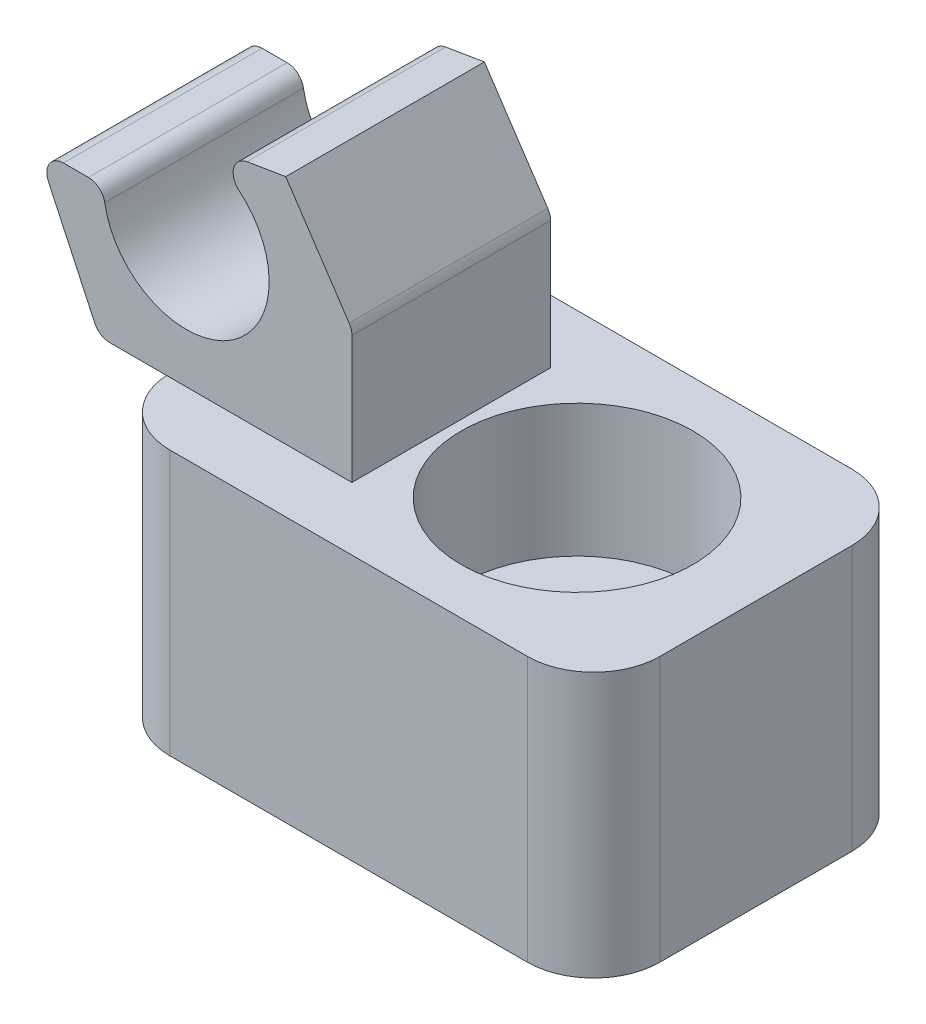
from build123d import *

# Parameters (mm, degrees)
BOSS_EXTRUDE1_DEPTH      = 8
SKETCH2_R                = 3.5
CUT_EXTRUDE1_DEPTH       = 4
SKETCH3_R                = 1.8
CUT_EXTRUDE2_DEPTH       = 4
BOSS_EXTRUDE2_DEPTH      = 3
BOSS_EXTRUDE2_DEPTH_BACK = 3
FILLET1_R                = 0.5


with BuildPart() as part:
    # Sketch1 → Boss-Extrude1 (new body)
    with BuildSketch(Plane(origin=(0, 0, 0), x_dir=(1, 0, 0), z_dir=(0, 1, 0))):
        with BuildLine():
            Line((-5.4, -4.9), (5.4, -4.9))
            ThreePointArc((5.4, -4.9), (6.814213562, -4.314213562), (7.4, -2.9))
            Line((7.4, -2.9), (7.4, 2.9))
            ThreePointArc((7.4, 2.9), (6.814213562, 4.314213562), (5.4, 4.9))
            Line((5.4, 4.9), (-5.4, 4.9))
            ThreePointArc((-5.4, 4.9), (-6.814213562, 4.314213562), (-7.4, 2.9))
            Line((-7.4, 2.9), (-7.4, -2.9))
            ThreePointArc((-7.4, -2.9), (-6.814213562, -4.314213562), (-5.4, -4.9))
        make_face()
    extrude(amount=BOSS_EXTRUDE1_DEPTH)

    # Sketch2 → Cut-Extrude1 (cut)
    with BuildSketch(Plane(origin=(0, 8, 0), x_dir=(1, 0, 0), z_dir=(0, 1, 0))):
        with Locations(Location((2, 0, 0), (0, 0, 270))):
            Circle(SKETCH2_R)
    extrude(amount=-CUT_EXTRUDE1_DEPTH, mode=Mode.SUBTRACT)

    # Sketch3 → Cut-Extrude2 (cut)
    with BuildSketch(Plane(origin=(0, 4, 0), x_dir=(1, 0, 0), z_dir=(0, 1, 0))):
        with Locations(Location((2, 0, 0), (0, 0, 270))):
            Circle(SKETCH3_R)
    extrude(amount=-CUT_EXTRUDE2_DEPTH, mode=Mode.SUBTRACT)

    # Sketch4 → Boss-Extrude2 (add, two sides: drawn at the far end of the back side and taken through both)
    with BuildSketch(Plane.XY.offset(-BOSS_EXTRUDE2_DEPTH_BACK)):
        with BuildLine():
            ThreePointArc((-9.3, 12), (-5.032233047, 10.232233047), (-6.8, 14.5))
            Line((-6.8, 14.5), (-3.8, 15))
            Line((-3.8, 15), (-1.8, 12))
            Line((-1.8, 12), (-1.8, 8))
            Line((-1.8, 8), (-7.4, 8))
            Line((-7.4, 8), (-9.434769367, 8))
            Line((-9.434769367, 8), (-11.3, 12))
            Line((-11.3, 12), (-9.3, 12))
        make_face()
    extrude(amount=BOSS_EXTRUDE2_DEPTH + BOSS_EXTRUDE2_DEPTH_BACK)

    # Fillet1
    fillet1_edges = [part.edges().sort_by_distance(p)[0] for p in [
        (-9.3, 12, 0),
        (-6.8, 14.5, 0),
        (-1.8, 12, 0),
        (-9.434769367, 8, 0),
        (-11.3, 12, 0),
    ]]
    fillet(fillet1_edges, radius=FILLET1_R)


solid = part.part
